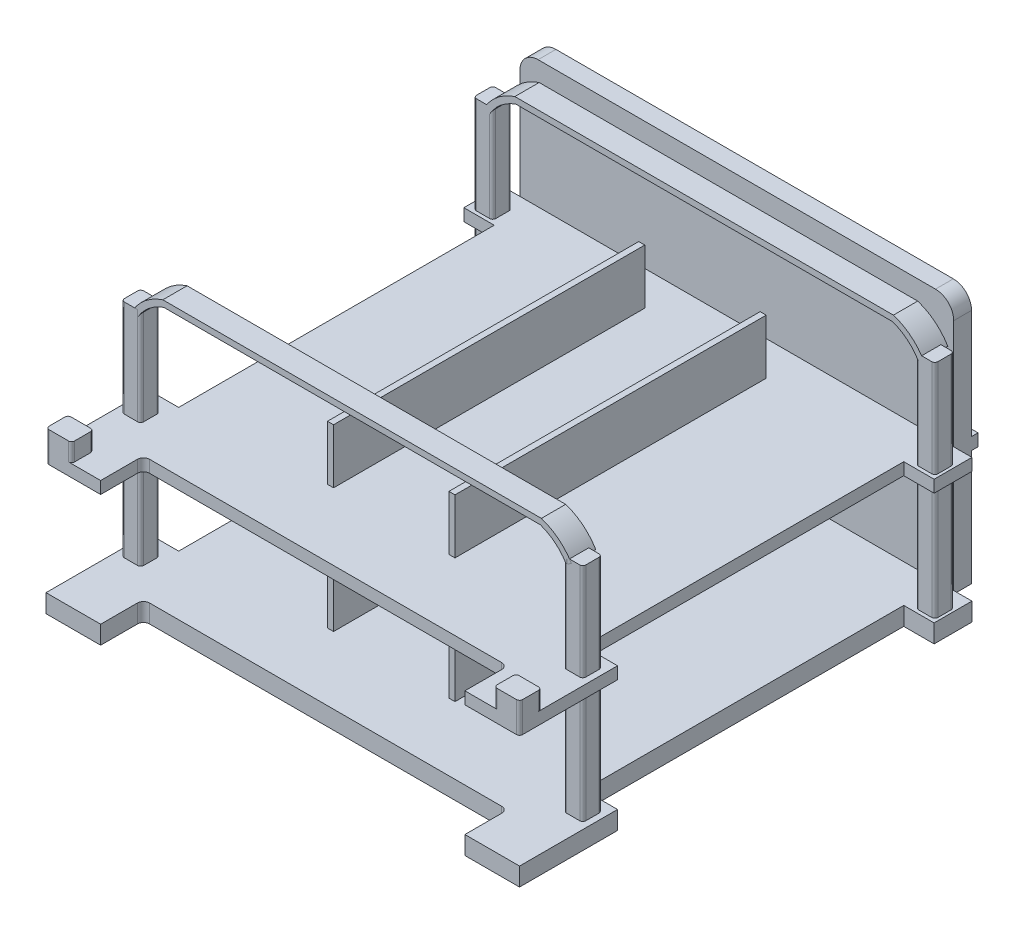
from build123d import *

# Parameters (mm, degrees)
BOSS_EXTRUDE1_DEPTH = 2
SKETCH2_W           = 3.173279943
SKETCH2_H           = 3.173279943
BOSS_EXTRUDE2_DEPTH = 16
EXTRUDE_THIN1_DEPTH = 4
EXTRUDE_THIN2_DEPTH = 4
BOSS_EXTRUDE3_DEPTH = 1.5
SKETCH7_W           = 3.173279943
SKETCH7_H           = 3.173279943
BOSS_EXTRUDE4_DEPTH = 18.5
SKETCH8_W           = 4.206840116
SKETCH8_H           = 3.626822683
BOSS_EXTRUDE5_DEPTH = 3
FILLET2_R           = 0.5
SKETCH9_W           = 71.459228046
SKETCH9_H           = 2
BOSS_EXTRUDE6_DEPTH = 4
SKETCH10_W          = 71.459228046
SKETCH10_H          = 2.935394116
BOSS_EXTRUDE7_DEPTH = 21
FILLET3_R           = 3
SKETCH11_W          = 1
SKETCH11_H          = 51.272919709
EXTRUDE_THIN3_DEPTH = 9
LPATTERN1_COUNT     = 2
LPATTERN1_PITCH     = 21


with BuildPart() as part:
    # Sketch1 → Boss-Extrude1 (new body)
    with BuildSketch(Plane(origin=(0, 0, 0), x_dir=(1, 0, 0), z_dir=(0, 1, 0))):
        with BuildLine():
            Line((0, 0), (9, 0))
            Line((9, 0), (9, 6.058535397))
            ThreePointArc((9, 6.058535397), (9.292893219, 6.765642178), (10, 7.058535397))
            Line((10, 7.058535397), (68, 7.058535397))
            ThreePointArc((68, 7.058535397), (68.707106781, 6.765642178), (69, 6.058535397))
            Line((69, 6.058535397), (69, 0))
            Line((69, 0), (78, 0))
            Line((78, 0), (78, 16.147046675))
            Line((78, 16.147046675), (72.459228046, 16.147046675))
            Line((72.459228046, 16.147046675), (72.459228046, 68.828972288))
            Line((72.459228046, 68.828972288), (77.459228046, 68.828972288))
            Line((77.459228046, 68.828972288), (77.459228046, 75.058535397))
            Line((77.459228046, 75.058535397), (0, 75.058535397))
            Line((0, 75.058535397), (0, 68.828972288))
            Line((0, 68.828972288), (5, 68.828972288))
            Line((5, 68.828972288), (5, 16.849705307))
            Line((5, 16.849705307), (0, 16.849705307))
            Line((0, 16.849705307), (0, 0))
        make_face()
    extrude(amount=BOSS_EXTRUDE1_DEPTH)

    # Sketch2 → Boss-Extrude2 (add)
    with BuildSketch(Plane(origin=(0, 2, 0), x_dir=(1, 0, 0), z_dir=(0, 1, 0))):
        with Locations((2.586639971, 13.005541643)):
            Rectangle(SKETCH2_W, SKETCH2_H)
        with Locations((75.413360028, 13.005541643)):
            Rectangle(SKETCH2_W, SKETCH2_H)
    boss_extrude2 = extrude(amount=BOSS_EXTRUDE2_DEPTH)

    # Mirror1: Boss-Extrude2 across plane
    add(boss_extrude2.mirror(Plane.XY.offset(-42)))

    # Sketch4 → Extrude-Thin2 (add)
    with BuildSketch(Plane.XY.offset(-69.407818386)):
        with BuildLine():
            ThreePointArc((3.723791162, 17), (5.546111849, 19.116564763), (7.984608164, 20.478341105))
            Line((7.984608164, 20.478341105), (70.015391836, 20.478341105))
            ThreePointArc((70.015391836, 20.478341105), (72.453888151, 19.116564763), (74.276208838, 17))
            Line((74.276208838, 17), (75.136218991, 17.510276921))
            ThreePointArc((75.136218991, 17.510276921), (73.018860874, 19.945712792), (70.178860217, 21.478341105))
            Line((70.178860217, 21.478341105), (7.821139783, 21.478341105))
            ThreePointArc((7.821139783, 21.478341105), (4.981139126, 19.945712792), (2.863781009, 17.510276921))
            Line((2.863781009, 17.510276921), (3.723791162, 17))
        make_face()
    extrude(amount=-EXTRUDE_THIN2_DEPTH)



with BuildPart() as body_2:
    # Sketch3 → Extrude-Thin1 (new body)
    with BuildSketch(Plane.XY.offset(-11.418901671)):
        with BuildLine():
            ThreePointArc((3.723791162, 17), (5.546111849, 19.116564763), (7.984608164, 20.478341105))
            Line((7.984608164, 20.478341105), (70.015391836, 20.478341105))
            ThreePointArc((70.015391836, 20.478341105), (72.453888151, 19.116564763), (74.276208838, 17))
            Line((74.276208838, 17), (75.136218991, 17.510276921))
            ThreePointArc((75.136218991, 17.510276921), (73.018860874, 19.945712792), (70.178860217, 21.478341105))
            Line((70.178860217, 21.478341105), (7.821139783, 21.478341105))
            ThreePointArc((7.821139783, 21.478341105), (4.981139126, 19.945712792), (2.863781009, 17.510276921))
            Line((2.863781009, 17.510276921), (3.723791162, 17))
        make_face()
    extrude(amount=-EXTRUDE_THIN1_DEPTH)


with BuildPart() as body_3:
    # Sketch6 → Boss-Extrude3 (new, symmetric)
    with BuildSketch(Plane(origin=(0, -20, 0), x_dir=(-1, 0, 0), z_dir=(0, -1, 0))):
        with BuildLine():
            Line((-9, 6.058535397), (-9, 0))
            Line((-9, 0), (0, 0))
            Line((0, 0), (0, 16.849705307))
            Line((0, 16.849705307), (-5, 16.849705307))
            Line((-5, 16.849705307), (-5, 68.828972288))
            Line((-5, 68.828972288), (0, 68.828972288))
            Line((0, 68.828972288), (0, 75.058535397))
            Line((0, 75.058535397), (-77.459228046, 75.058535397))
            Line((-77.459228046, 75.058535397), (-77.459228046, 68.828972288))
            Line((-77.459228046, 68.828972288), (-72.459228046, 68.828972288))
            Line((-72.459228046, 68.828972288), (-72.459228046, 16.147046675))
            Line((-72.459228046, 16.147046675), (-78, 16.147046675))
            Line((-78, 16.147046675), (-78, 0))
            Line((-78, 0), (-69, 0))
            Line((-69, 0), (-69, 6.058535397))
            ThreePointArc((-69, 6.058535397), (-68.707106781, 6.765642178), (-68, 7.058535397))
            Line((-68, 7.058535397), (-10, 7.058535397))
            ThreePointArc((-10, 7.058535397), (-9.292893219, 6.765642178), (-9, 6.058535397))
        make_face()
    extrude(amount=BOSS_EXTRUDE3_DEPTH, both=True)


with BuildPart() as part_1:
    add(part.part)

    add(body_3.part)  # Boss-Extrude4 merges body 3
    # Sketch7 → Boss-Extrude4 (add)
    with BuildSketch(Plane(origin=(0, -18.5, 0), x_dir=(1, 0, 0), z_dir=(0, 1, 0))):
        with Locations((75.413360028, 13.005541643)):
            Rectangle(SKETCH7_W, SKETCH7_H)
        with Locations((2.586639971, 13.005541643)):
            Rectangle(SKETCH7_W, SKETCH7_H)
        with Locations((75.413360028, 70.994458358)):
            Rectangle(SKETCH7_W, SKETCH7_H)
        with Locations((2.586639971, 70.994458358)):
            Rectangle(SKETCH7_W, SKETCH7_H)
    extrude(amount=BOSS_EXTRUDE4_DEPTH)

    # Sketch8 → Boss-Extrude5 (add)
    with BuildSketch(Plane(origin=(0, 2, 0), x_dir=(1, 0, 0), z_dir=(0, 1, 0))):
        with Locations((2.103420058, 1.813411342)):
            Rectangle(SKETCH8_W, SKETCH8_H)
        with Locations((75.896579942, 1.813411342)):
            Rectangle(SKETCH8_W, SKETCH8_H)
    extrude(amount=BOSS_EXTRUDE5_DEPTH)

    # Fillet2
    fillet2_edges = [part_1.edges().sort_by_distance(p)[0] for p in [
        (77, -9.25, -11.418901671),
        (1, -9.25, -14.592181614),
        (1, -9.25, -11.418901671),
        (4.173279943, -9.25, -11.418901671),
        (73.826720057, -9.25, -11.418901671),
        (73.826720057, -9.25, -14.592181614),
        (4.173279943, -9.25, -14.592181614),
        (77, -9.25, -14.592181614),
        (77, -9.25, -69.407818386),
        (73.826720057, -9.25, -69.407818386),
        (73.826720057, -9.25, -72.581098329),
        (77, -9.25, -72.581098329),
        (78, 2.5, 0),
        (73.793159884, 3.5, 0),
        (78, 3.5, -3.626822683),
        (73.793159884, 3.5, -3.626822683),
        (73.826720057, 10, -11.418901671),
        (73.826720057, 10, -14.592181614),
        (77, 10, -14.592181614),
        (77, 10, -11.418901671),
        (73.826720057, 9.838386642, -72.581098329),
        (73.826720057, 9.838386642, -69.407818386),
        (77, 10, -72.581098329),
        (77, 10, -69.407818386),
        (4.173279943, 9.838386642, -72.581098329),
        (4.173279943, 9.838386642, -69.407818386),
        (1, 10, -72.581098329),
        (1, 10, -69.407818386),
        (4.173279943, 10, -14.592181614),
        (4.173279943, 10, -11.418901671),
        (1, 10, -14.592181614),
        (1, 10, -11.418901671),
        (0, 3.5, -3.626822683),
        (4.206840116, 3.5, -3.626822683),
        (4.206840116, 3.5, 0),
        (0, 2.5, 0),
        (1, -9.25, -72.581098329),
        (4.173279943, -9.25, -72.581098329),
        (4.173279943, -9.25, -69.407818386),
        (1, -9.25, -69.407818386),
    ]]
    fillet(fillet2_edges, radius=FILLET2_R)

    # Sketch9 → Boss-Extrude6 (add)
    with BuildSketch(Plane(origin=(0, 0, -75.058535397), x_dir=(-1, 0, 0), z_dir=(0, 0, -1))):
        with Locations((-38.729614023, 1)):
            Rectangle(SKETCH9_W, SKETCH9_H)
    extrude(amount=BOSS_EXTRUDE6_DEPTH)

    # Sketch10 → Boss-Extrude7 (add, symmetric)
    with BuildSketch(Plane(origin=(0, 2, 0), x_dir=(1, 0, 0), z_dir=(0, 1, 0))):
        with Locations((38.729614023, 76.526232455)):
            Rectangle(SKETCH10_W, SKETCH10_H)
    extrude(amount=BOSS_EXTRUDE7_DEPTH, both=True)

    # Fillet3
    fillet3_edges = [part_1.edges().sort_by_distance(p)[0] for p in [
        (3, 23, -76.526232455),
        (74.459228046, 23, -76.526232455),
    ]]
    fillet(fillet3_edges, radius=FILLET3_R)

    # Sketch11 → Extrude-Thin3 (add)
    with BuildSketch(Plane(origin=(0, 2, 0), x_dir=(1, 0, 0), z_dir=(0, 1, 0))):
        with Locations((28.729614023, 43.771358531)):
            Rectangle(SKETCH11_W, SKETCH11_H)
        with Locations((48.729614023, 43.771358531)):
            Rectangle(SKETCH11_W, SKETCH11_H)
    extrude_thin3 = extrude(amount=EXTRUDE_THIN3_DEPTH)

    # LPattern1: Extrude-Thin3 ×2
    with Locations(*[(0, -i * LPATTERN1_PITCH, 0) for i in range(1, LPATTERN1_COUNT)]):
        add(extrude_thin3)


solid = Compound([body_2.part, part_1.part])
